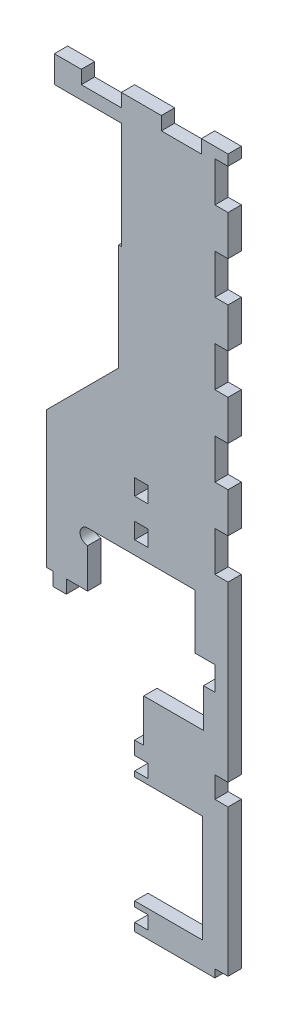
from build123d import *

# Parameters (mm, degrees)
BOSS_EXTRU_1_DEPTH      = 5
ESQUISSE2_R             = 2.8575
ESQUISSE2_W             = 5
ESQUISSE2_H             = 6
ESQUISSE2_W_2           = 4.274370263
ESQUISSE2_H_2           = 8.980069935
ESQUISSE2_W_3           = 4.92
ESQUISSE2_H_3           = 3
ESQUISSE2_H_4           = 8
ESQUISSE2_H_5           = 15
ESQUISSE2_W_4           = 15
ESQUISSE2_H_6           = 5
ESQUISSE2_W_5           = 1
ESQUISSE2_H_7           = 40
ENL_V_MAT_EXTRU_1_DEPTH = 5
ESQUISSE3_W             = 5
ESQUISSE3_H             = 5
BOSS_EXTRU_2_DEPTH      = 5


with BuildPart() as part:
    # Esquisse1 → Boss.-Extru.1 (new body)
    with BuildSketch(Plane.XY):
        Polygon((65.121094869, 0), (30.122364869, 0), (30.122364869, 3), (35.122364869, 3), (35.122364869, 8), (30.122364869, 8), (30.122364869, 10), (55.617614869, 10), (55.617614869, 50.2), (30.122364869, 50.2), (30.122364869, 52.2), (35.122364869, 52.2), (35.122364869, 57.2), (30.122364869, 57.2), (30.122364869, 62.2), (33.512280837, 62.2), (33.512280837, 78.240708175), (55.911629737, 78.240708175), (55.911629737, 101.750434868), (52.693, 101.750434868), (52.693, 122.246954868), (12.493, 122.246954868), (12.493, 101.750434868), (-2.878905131, 101.750434868), (-2.878905131, 153), (24.121094869, 180), (24.121094869, 260), (0, 260), (0, 270), (65.121094869, 270), align=None)
    extrude(amount=-BOSS_EXTRU_1_DEPTH)

    # Esquisse2 → Enlèv. mat.-Extru.1 (cut)
    with BuildSketch(Plane.XY):
        with Locations((12.493, 119.389454868)):
            Circle(ESQUISSE2_R)
        with Locations((32.622364869, 144.401636706)):
            Rectangle(ESQUISSE2_W, ESQUISSE2_H)
        with Locations((32.622364869, 130.246954868)):
            Rectangle(ESQUISSE2_W, ESQUISSE2_H)
        with Locations((58.048814869, 97.260399901)):
            Rectangle(ESQUISSE2_W_2, ESQUISSE2_H_2)
        with Locations((62.661094869, 1.5)):
            Rectangle(ESQUISSE2_W_3, ESQUISSE2_H_3)
        with Locations((62.661094869, 62)):
            Rectangle(ESQUISSE2_W_3, ESQUISSE2_H_4)
        with Locations((62.661094869, 168.5)):
            Rectangle(ESQUISSE2_W_3, ESQUISSE2_H_5)
        with Locations((62.661094869, 138.5)):
            Rectangle(ESQUISSE2_W_3, ESQUISSE2_H_5)
        with Locations((62.661094869, 198.5)):
            Rectangle(ESQUISSE2_W_3, ESQUISSE2_H_5)
        with Locations((62.661094869, 228.5)):
            Rectangle(ESQUISSE2_W_3, ESQUISSE2_H_5)
        with Locations((62.661094869, 258.5)):
            Rectangle(ESQUISSE2_W_3, ESQUISSE2_H_5)
        with Locations((47.621094869, 267.5)):
            Rectangle(ESQUISSE2_W_4, ESQUISSE2_H_6)
        with Locations((17.621094869, 267.5)):
            Rectangle(ESQUISSE2_W_4, ESQUISSE2_H_6)
        with Locations((24.621094869, 240)):
            Rectangle(ESQUISSE2_W_5, ESQUISSE2_H_7)
    extrude(amount=-ENL_V_MAT_EXTRU_1_DEPTH, mode=Mode.SUBTRACT)

    # Esquisse3 → Boss.-Extru.2 (add)
    with BuildSketch(Plane.XY):
        with Locations((1.993, 99.250434868)):
            Rectangle(ESQUISSE3_W, ESQUISSE3_H)
    extrude(amount=-BOSS_EXTRU_2_DEPTH)


solid = part.part
